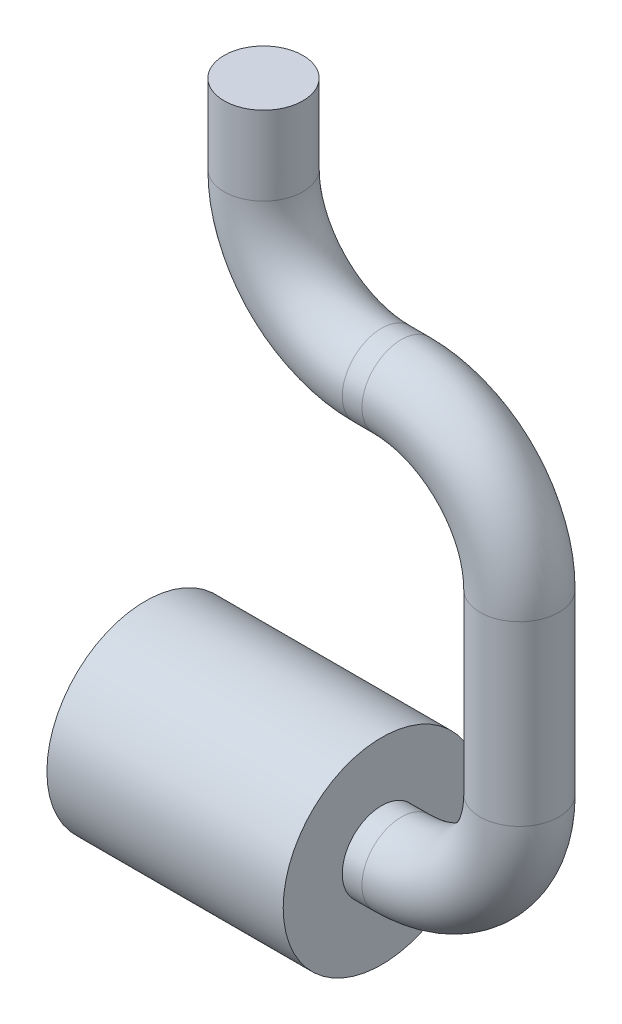
from build123d import *

# Parameters (mm, degrees)
SKETCH1_R           = 12.5
BOSS_EXTRUDE1_DEPTH = 15
SKETCH8_R           = 5


with BuildPart() as part:
    # Sketch1 → Boss-Extrude1 (new, symmetric)
    with BuildSketch(Plane(origin=(0, 0, 0), x_dir=(0, 0, -1), z_dir=(1, 0, 0))):
        Circle(SKETCH1_R)
    extrude(amount=BOSS_EXTRUDE1_DEPTH, both=True)

    # Sweep1: sweep along a path in Sketch7
    with BuildLine(Plane.XY) as sweep1_path:
        Line((15, 0), (17.5, 0))
        ThreePointArc((17.5, 0), (28.106601718, 4.393398282), (32.5, 15))
        Line((32.5, 15), (32.5, 37.5))
        ThreePointArc((32.5, 37.5), (28.106601718, 48.106601718), (17.5, 52.5))
        Line((17.5, 52.5), (15, 52.5))
        ThreePointArc((15, 52.5), (4.393398282, 56.893398282), (0, 67.5))
        Line((0, 67.5), (0, 77.5))
    # Sketch8 → Sweep1 (sweep)
    with BuildSketch(Plane(origin=(15, 0, 0), x_dir=(0, 0, -1), z_dir=(1, 0, 0))):
        Circle(SKETCH8_R)
    sweep(path=sweep1_path.line)


solid = part.part
